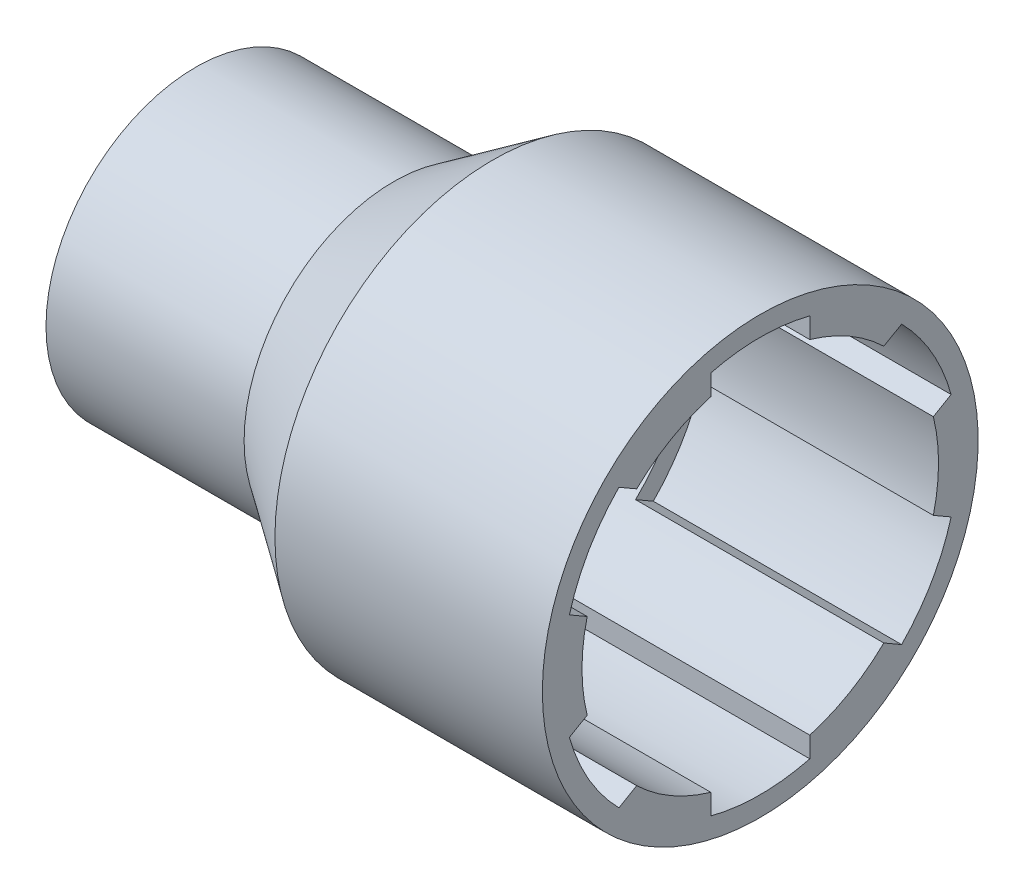
from build123d import *

# Parameters (mm, degrees)
CUT_EXTRUDE1_DEPTH      = 30
CUT_EXTRUDE1_DEPTH_BACK = 5
BOSS_EXTRUDE1_DEPTH     = 73
CUT_EXTRUDE2_DEPTH      = 20
CUT_EXTRUDE2_DEPTH_BACK = 20
SKETCH5_W               = 66.529199046
SKETCH5_H               = 33.448723993
BOSS_EXTRUDE3_DEPTH     = 20
CUT_EXTRUDE3_DEPTH      = 20
CIRPATTERN1_COUNT       = 6


with BuildPart() as part:
    # Sketch1 → Revolve1 (revolve)
    with BuildSketch(Plane.XY, mode=Mode.PRIVATE) as revolve1_sk:
        Polygon((9.842999887, 11.113), (29.842999887, 11.113), (39.842999887, 18), (66.842999887, 18), (66.842999887, 22), (39.842999887, 22), (29.842999887, 15.113), (9.842999887, 15.113), align=None)
    revolve(revolve1_sk.sketch.rotate(Axis((-3.645367966, 0, 0), (1, 0, 0)), 90), axis=Axis((-3.645367966, 0, 0), (1, 0, 0)))

    # Sketch2 → Cut-Extrude1 (cut, two sides: drawn at the far end of the back side and taken through both)
    with BuildSketch(Plane(origin=(46.7775, 0, 0), x_dir=(0, 0, -1), z_dir=(1, 0, 0)).offset(-CUT_EXTRUDE1_DEPTH_BACK)):
        with BuildLine():
            Line((-5, 8.659676688), (-14.270871629, 14.012216918))
            ThreePointArc((-14.270871629, 14.012216918), (-15.866085859, 12.176506869), (-17.226698597, 10.160750732))
            Line((-17.226698597, 10.160750732), (-17.412817554, 9.838383242))
            ThreePointArc((-17.412817554, 9.838383242), (-18.478009625, 7.652657074), (-19.270095188, 5.353824003))
            Line((-19.270095188, 5.353824003), (-9.999, 0.001154701))
            Line((-9.999, 0.001154701), (-5, 2.887328696))
            Line((-5, 2.887328696), (-5, 8.659676688))
        make_face()
        with BuildLine():
            Line((0.001, 5.774657392), (5, 8.660831388))
            Line((5, 8.660831388), (5, 19.364916731))
            ThreePointArc((5, 19.364916731), (0.001032782, 19.999999973), (-4.998, 19.365433019))
            Line((-4.998, 19.365433019), (-4.998, 8.660831388))
            Line((-4.998, 8.660831388), (0.001, 5.774657392))
        make_face()
        with BuildLine():
            Line((10.001, 0.001154701), (19.270371629, 5.352828906))
            ThreePointArc((19.270371629, 5.352828906), (17.320766265, 9.999552789), (14.271595188, 14.011479965))
            Line((14.271595188, 14.011479965), (5.002, 8.659676688))
            Line((5.002, 8.659676688), (5.002, 2.887328696))
            Line((5.002, 2.887328696), (10.001, 0.001154701))
        make_face()
        with BuildLine():
            Line((19.270371629, -5.352828906), (10.001, -0.001154701))
            Line((10.001, -0.001154701), (5.002, -2.887328696))
            Line((5.002, -2.887328696), (5.002, -8.659676688))
            Line((5.002, -8.659676688), (14.271595188, -14.011479965))
            ThreePointArc((14.271595188, -14.011479965), (17.320766265, -9.999552789), (19.270371629, -5.352828906))
        make_face()
        with BuildLine():
            Line((5, -8.660831388), (0.001, -5.774657392))
            Line((0.001, -5.774657392), (-4.998, -8.660831388))
            Line((-4.998, -8.660831388), (-4.998, -19.365433019))
            ThreePointArc((-4.998, -19.365433019), (0.001032782, -19.999999973), (5, -19.364916731))
            Line((5, -19.364916731), (5, -8.660831388))
        make_face()
        with BuildLine():
            Line((-14.270871629, -14.012216918), (-5, -8.659676688))
            Line((-5, -8.659676688), (-5, -2.887328696))
            Line((-5, -2.887328696), (-9.999, -0.001154701))
            Line((-9.999, -0.001154701), (-19.270095188, -5.353824003))
            ThreePointArc((-19.270095188, -5.353824003), (-18.478009625, -7.652657074), (-17.412817554, -9.838383242))
            Line((-17.412817554, -9.838383242), (-17.226698597, -10.160750732))
            ThreePointArc((-17.226698597, -10.160750732), (-15.866085859, -12.176506869), (-14.270871629, -14.012216918))
        make_face()
    extrude(amount=CUT_EXTRUDE1_DEPTH + CUT_EXTRUDE1_DEPTH_BACK, mode=Mode.SUBTRACT)

    # Sketch3 → Boss-Extrude1 (add)
    with BuildSketch(Plane(origin=(-43.2225, 0, 0), x_dir=(0, 0, -1), z_dir=(1, 0, 0))):
        with BuildLine():
            Line((10.03247637, 2.905284302), (10.603848258, 3.325232492))
            ThreePointArc((10.603848258, 3.325232492), (9.677413399, 5.58840998), (8.18031613, 7.522047395))
            Line((8.18031613, 7.522047395), (7.531056114, 7.236900729))
            ThreePointArc((7.531056114, 7.236900729), (8.562885859, 4.944693552), (10.03247637, 2.905284302))
        make_face()
        with BuildLine():
            Line((7.532288195, -7.235737248), (8.18165994, -7.520585723))
            ThreePointArc((8.18165994, -7.520585723), (9.678411709, -5.586680857), (10.604442198, -3.323337882))
            Line((10.604442198, -3.323337882), (10.032867932, -2.903635548))
            ThreePointArc((10.032867932, -2.903635548), (8.56367316, -4.943329907), (7.532288195, -7.235737248))
        make_face()
        with BuildLine():
            Line((-2.500188174, -10.14102155), (-2.422188317, -10.845818215))
            ThreePointArc((-2.422188317, -10.845818215), (0.00099831, -11.175090837), (2.424126068, -10.845385277))
            Line((2.424126068, -10.845385277), (2.501811819, -10.140536276))
            ThreePointArc((2.501811819, -10.140536276), (0.000787301, -9.88802346), (-2.500188174, -10.14102155))
        make_face()
        with BuildLine():
            Line((-10.03247637, -2.905284302), (-10.603848258, -3.325232492))
            ThreePointArc((-10.603848258, -3.325232492), (-9.677413399, -5.58840998), (-8.18031613, -7.522047395))
            Line((-8.18031613, -7.522047395), (-7.531056114, -7.236900729))
            ThreePointArc((-7.531056114, -7.236900729), (-8.562885859, -4.944693552), (-10.03247637, -2.905284302))
        make_face()
        with BuildLine():
            Line((-7.532288195, 7.235737248), (-8.18165994, 7.520585723))
            ThreePointArc((-8.18165994, 7.520585723), (-9.678411709, 5.586680857), (-10.604442198, 3.323337882))
            Line((-10.604442198, 3.323337882), (-10.032867932, 2.903635548))
            ThreePointArc((-10.032867932, 2.903635548), (-8.56367316, 4.943329907), (-7.532288195, 7.235737248))
        make_face()
        with BuildLine():
            Line((2.500188174, 10.14102155), (2.422188317, 10.845818215))
            ThreePointArc((2.422188317, 10.845818215), (-0.00099831, 11.175090837), (-2.424126068, 10.845385277))
            Line((-2.424126068, 10.845385277), (-2.501811819, 10.140536276))
            ThreePointArc((-2.501811819, 10.140536276), (-0.000787301, 9.88802346), (2.500188174, 10.14102155))
        make_face()
    extrude(amount=BOSS_EXTRUDE1_DEPTH)

    # Sketch5 → Cut-Extrude2 (cut, two sides: drawn at the far end of the back side and taken through both)
    with BuildSketch(Plane.XY.offset(-CUT_EXTRUDE2_DEPTH_BACK)):
        with Locations((-23.421599636, -1.611361997)):
            Rectangle(SKETCH5_W, SKETCH5_H)
    extrude(amount=CUT_EXTRUDE2_DEPTH + CUT_EXTRUDE2_DEPTH_BACK, mode=Mode.SUBTRACT)

    # Sketch6 → Boss-Extrude3 (add)
    with BuildSketch(Plane(origin=(9.7775, 0, 0), x_dir=(0, 0, -1), z_dir=(1, 0, 0))):
        with BuildLine():
            ThreePointArc((2.661916341, 10.789484251), (2.542208375, 10.818315284), (2.422188317, 10.845818215))
            Line((2.422188317, 10.845818215), (2.501811819, 10.140536276))
            Line((2.501811819, 10.140536276), (2.661916341, 10.789484251))
        make_face()
        with BuildLine():
            Line((-2.661916341, 10.789484251), (-2.501811819, 10.140536276))
            Line((-2.501811819, 10.140536276), (-2.424126068, 10.845385277))
            ThreePointArc((-2.424126068, 10.845385277), (-2.543174803, 10.818088136), (-2.661916341, 10.789484251))
        make_face()
    extrude(amount=BOSS_EXTRUDE3_DEPTH)

    # Sketch7 → Cut-Extrude3 (cut, symmetric)
    with BuildSketch(Plane(origin=(9.842999887, 0, 0), x_dir=(0, 0, -1), z_dir=(1, 0, 0))):
        with BuildLine():
            Line((2.422188317, 10.845818215), (2.422188317, 10.1253438))
            Line((2.422188317, 10.1253438), (2.532529127, 10.096901244))
            Line((2.532529127, 10.096901244), (2.554732852, 10.240216199))
            Line((2.554732852, 10.240216199), (3.06458678, 10.682091409))
            ThreePointArc((3.06458678, 10.682091409), (2.74460869, 10.76874608), (2.422188317, 10.845818215))
        make_face()
        with BuildLine():
            Line((-2.532529127, 10.096901244), (-2.422188317, 10.1253438))
            Line((-2.422188317, 10.1253438), (-2.422188317, 10.845818215))
            ThreePointArc((-2.422188317, 10.845818215), (-2.74460869, 10.76874608), (-3.06458678, 10.682091409))
            Line((-3.06458678, 10.682091409), (-2.554732852, 10.240216199))
            Line((-2.554732852, 10.240216199), (-2.532529127, 10.096901244))
        make_face()
    cut_extrude3 = extrude(amount=CUT_EXTRUDE3_DEPTH, both=True, mode=Mode.SUBTRACT)

    # CirPattern1: Cut-Extrude3 ×6 about axis
    cirpattern1_axis = Axis((0, 0, 0), (1, 0, 0))
    for i in range(1, CIRPATTERN1_COUNT):
        add(cut_extrude3.rotate(cirpattern1_axis, i * 360 / CIRPATTERN1_COUNT), mode=Mode.SUBTRACT)


solid = part.part
